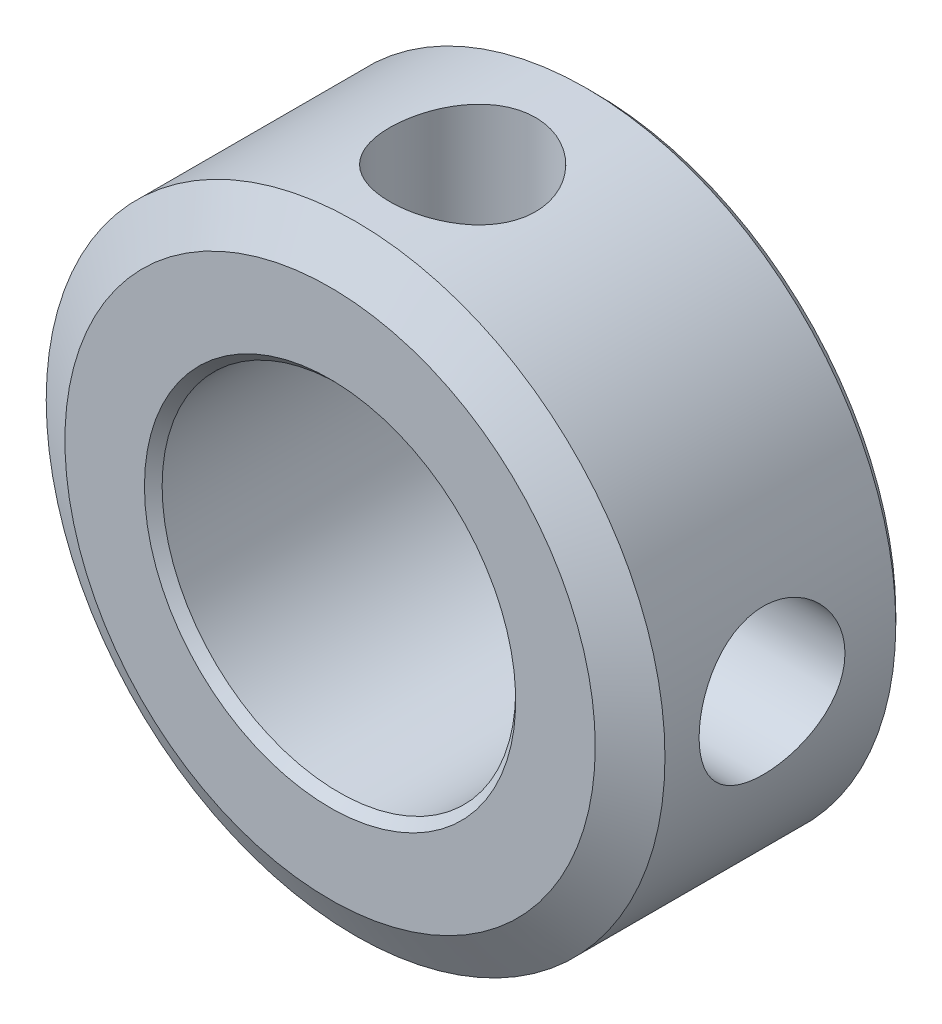
from build123d import *

# Parameters (mm, degrees)
SKETCH1_W           = 6
SKETCH1_H           = 3
TAPPED_HOLE1_REACH  = 18.763
TAPPED_HOLE1_BORE_R = 1.65
CIRPATTERN1_COUNT   = 2
CIRPATTERN1_ANGLE   = 90
CHAMFER1_SIZE       = 0.2


with BuildPart() as part:
    # Sketch1 → Revolve1 (revolve)
    with BuildSketch(Plane(origin=(0, 0, 0), x_dir=(0, 0, -1), z_dir=(1, 0, 0)), mode=Mode.PRIVATE) as revolve1_sk:
        with Locations((3, 5.5)):
            Rectangle(SKETCH1_W, SKETCH1_H)
    revolve(revolve1_sk.sketch.rotate(Axis((0, 0, 0), (0, 0, -1)), 90), axis=Axis((0, 0, 0), (0, 0, -1)))

    # Tapped Hole1 bore → Tapped Hole1 (cut, up to next)
    with BuildSketch(Plane(origin=(0, 7, 0), x_dir=(1, 0, 0), z_dir=(0, 1, 0)), mode=Mode.PRIVATE) as tapped_hole1_sk1:
        with Locations((0, 3)):
            Circle(TAPPED_HOLE1_BORE_R)
    tapped_hole1_tool1 = extrude(tapped_hole1_sk1.sketch, amount=-TAPPED_HOLE1_REACH, mode=Mode.PRIVATE) & part.part
    tapped_hole1 = tapped_hole1_tool1.solids().sort_by_distance((0, 7, -3))[0]
    add(tapped_hole1, mode=Mode.SUBTRACT)

    # CirPattern1: Tapped Hole1 ×2 about axis
    cirpattern1_axis = Axis((0, 0, 0), (0, 0, -1))
    for i in range(1, CIRPATTERN1_COUNT):
        add(tapped_hole1.rotate(cirpattern1_axis, i * CIRPATTERN1_ANGLE / (CIRPATTERN1_COUNT - 1)), mode=Mode.SUBTRACT)

    # Chamfer1
    chamfer1_edges = [part.edges().sort_by_distance(p)[0] for p in [
        (-4, 0, -6),
        (-4, 0, 0),
        (-7, 0, -6),
    ]]
    chamfer(chamfer1_edges, length=CHAMFER1_SIZE)

    # Sketch4 → Cut-Revolve1 (revolve, cut)
    with BuildSketch(Plane(origin=(0, 0, 0), x_dir=(0, 0, -1), z_dir=(1, 0, 0)), mode=Mode.PRIVATE) as cut_revolve1_sk:
        Polygon((0.577350269, 7), (0, 6), (0, 7), align=None)
    revolve(cut_revolve1_sk.sketch.rotate(Axis((0, 0, 0), (0, 0, -1)), 90), axis=Axis((0, 0, 0), (0, 0, -1)), mode=Mode.SUBTRACT)


solid = part.part
